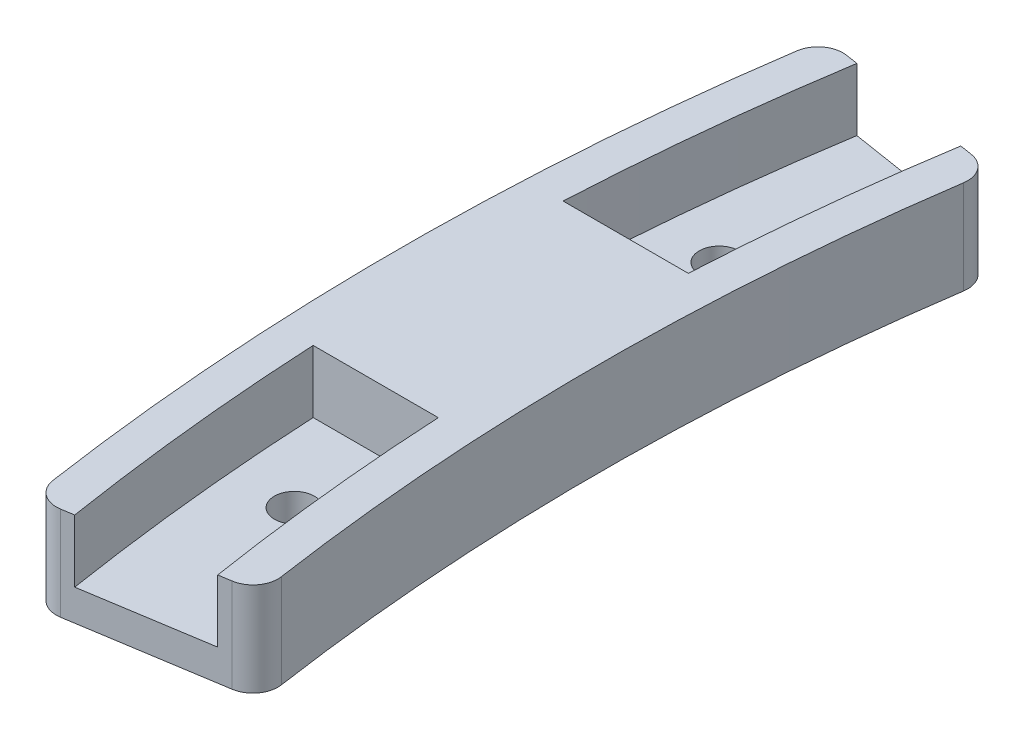
from build123d import *

# Parameters (mm, degrees)
BOSS_EXTRUDE1_DEPTH        = 10
CUT_EXTRUDE1_DEPTH         = 5
FILLET1_R                  = 2
CUT_EXTRUDE2_START         = -2.5
CUT_EXTRUDE2_DEPTH         = 2.5
F_3_2_3_2_DIAMETER_HOLE1_D = 3.2


with BuildPart() as part:
    # Sketch1 → Boss-Extrude1 (new body)
    with BuildSketch(Plane(origin=(0, 0, 0), x_dir=(1, 0, 0), z_dir=(0, 1, 0))):
        with BuildLine():
            ThreePointArc((-187.660784713, 29.722548358), (-190, 0), (-187.660784713, -29.722548358))
            Line((-187.660784713, -29.722548358), (-197.537668119, -31.286893008))
            ThreePointArc((-197.537668119, -31.286893008), (-200, 0), (-197.537668119, 31.286893008))
            Line((-197.537668119, 31.286893008), (-187.660784713, 29.722548358))
        make_face()
        with BuildLine():
            ThreePointArc((-197.537668119, -31.286893008), (-200, 0), (-197.537668119, 31.286893008))
            Line((-197.537668119, 31.286893008), (-200.500733141, 31.756196403))
            ThreePointArc((-200.500733141, 31.756196403), (-203, 0), (-200.500733141, -31.756196403))
            Line((-200.500733141, -31.756196403), (-197.537668119, -31.286893008))
        make_face()
        with BuildLine():
            Line((-184.697719691, 29.253244963), (-187.660784713, 29.722548358))
            ThreePointArc((-187.660784713, 29.722548358), (-190, 0), (-187.660784713, -29.722548358))
            Line((-187.660784713, -29.722548358), (-184.697719691, -29.253244963))
            ThreePointArc((-184.697719691, -29.253244963), (-187, 0), (-184.697719691, 29.253244963))
        make_face()
    extrude(amount=BOSS_EXTRUDE1_DEPTH)

    # Sketch15 → Cut-Extrude1 (cut)
    with BuildSketch(Plane(origin=(0, 10, 0), x_dir=(1, 0, 0), z_dir=(0, 1, 0))):
        with BuildLine():
            Line((-199.749843554, 10), (-189.73665961, 10))
            ThreePointArc((-189.73665961, 10), (-188.956218405, 19.88837666), (-187.660784713, 29.722548358))
            Line((-187.660784713, 29.722548358), (-197.537668119, 31.286893008))
            ThreePointArc((-197.537668119, 31.286893008), (-198.928692466, 20.673057674), (-199.749843554, 10))
        make_face()
        with BuildLine():
            ThreePointArc((-187.660784713, -29.722548358), (-188.956218405, -19.88837666), (-189.73665961, -10))
            Line((-189.73665961, -10), (-199.749843554, -10))
            ThreePointArc((-199.749843554, -10), (-198.928692466, -20.673057674), (-197.537668119, -31.286893008))
            Line((-197.537668119, -31.286893008), (-187.660784713, -29.722548358))
        make_face()
    extrude(amount=-CUT_EXTRUDE1_DEPTH, mode=Mode.SUBTRACT)

    # Fillet1
    fillet1_edges = [part.edges().sort_by_distance(p)[0] for p in [
        (-200.500733141, 5, 31.756196403),
        (-200.500733141, 5, -31.756196403),
        (-184.697719691, 5, -29.253244963),
        (-184.697719691, 5, 29.253244963),
    ]]
    fillet(fillet1_edges, radius=FILLET1_R)

    # Sketch19 → Cut-Extrude2 (cut)
    with BuildSketch(Plane.XZ.offset(CUT_EXTRUDE2_START)):
        with BuildLine():
            Line((-198.515528472, -31.441770873), (-186.662644351, -29.564458455))
            ThreePointArc((-186.662644351, -29.564458455), (-185.363721979, -28.773196969), (-184.996936421, -27.297133819))
            ThreePointArc((-184.996936421, -27.297133819), (-187, 0), (-184.996936421, 27.297133819))
            ThreePointArc((-184.996936421, 27.297133819), (-185.363721979, 28.773196969), (-186.662644351, 29.564458455))
            Line((-186.662644351, 29.564458455), (-198.515528472, 31.441770873))
            ThreePointArc((-198.515528472, 31.441770873), (-200.012003377, 31.078559473), (-200.806789416, 29.759592144))
            ThreePointArc((-200.806789416, 29.759592144), (-203, 0), (-200.806789416, -29.759592144))
            ThreePointArc((-200.806789416, -29.759592144), (-200.012003377, -31.078559473), (-198.515528472, -31.441770873))
        make_face()
    extrude(amount=CUT_EXTRUDE2_DEPTH, mode=Mode.SUBTRACT)

    # Ø3.2 (3.2) Diameter Hole1 (through all)
    with Locations(Plane(origin=(0, 2.5, 0), x_dir=(-1, 0, 0), z_dir=(0, -1, 0))):
        with Locations((194.257966128, 16.995369836), (194.257966128, -16.995369836)):
            Hole(F_3_2_3_2_DIAMETER_HOLE1_D / 2)


solid = part.part
